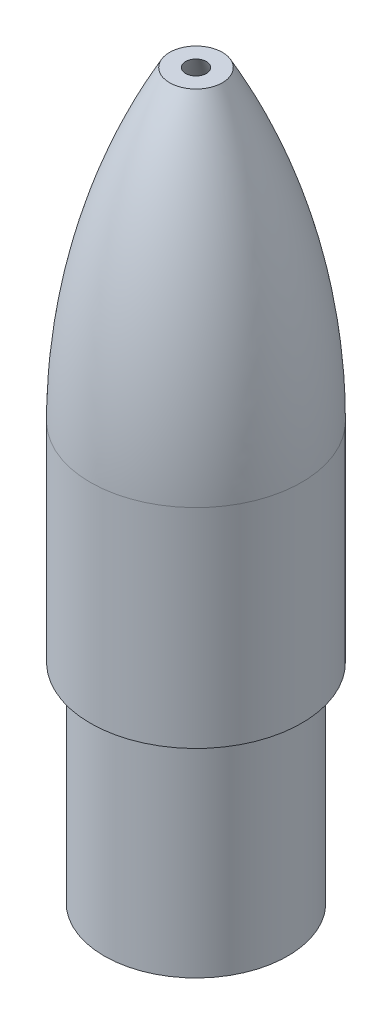
from build123d import *

# Parameters (mm, degrees)
BOSS_EXTRUDE1_START = -300
SKETCH2_R           = 66
SKETCH2_R_2         = 58
BOSS_EXTRUDE1_DEPTH = 300
SKETCH3_R           = 132.244783432
CUT_EXTRUDE1_DEPTH  = 30


with BuildPart() as part:
    # Sketch1 → Revolve3 (revolve)
    with BuildSketch(Plane.XY, mode=Mode.PRIVATE) as revolve3_sk:
        with BuildLine():
            Line((76, -0.344450695), (76, 149.655549305))
            add(Edge.make_bspline(
                [(0.773326773, 400), (0.980987301, 399.685666805), (1.398059308, 399.052178662), (2.284541161, 397.700550841), (3.251241341, 396.211212549), (4.217116507, 394.710095548), (5.194582422, 393.178406868), (6.158529674, 391.654155139), (7.117841951, 390.123894266), (8.076303348, 388.581395306), (9.033719413, 387.026713906), (16.961041975, 374.037008419), (28.571782608, 353.014913091), (42.416505119, 323.258697721), (56.925249661, 282.331206246), (67.374040256, 242.08025425), (72.64853455, 209.220016816), (74.898010785, 183.923611768), (75.587535098, 169.173424136), (75.711753269, 165.955632222), (75.799260065, 163.208321649), (75.849799507, 161.393000412), (75.892883214, 159.587415565), (75.928787343, 157.784317211), (75.957511328, 155.967426666), (75.979054713, 154.18293971), (75.99341716, 152.40648291), (75.99880312, 150.790982345), (76, 150.032282914), (76, 149.655549305)],
                knots=[0.082616428, 0.082616428, 0.082616428, 0.082616428, 0.082616428, 0.088299706, 0.093982984, 0.099666263, 0.105349541, 0.111032819, 0.116716097, 0.122399375, 0.128082653, 0.133891142, 0.139699631, 0.313954311, 0.430124092, 0.546293874, 0.685697612, 0.836718331, 0.848335309, 0.865760775, 0.871569264, 0.877252541, 0.882935819, 0.888619096, 0.894302373, 0.899985651, 0.905668928, 0.911352205, 0.917035483, 0.917035483, 0.917035483, 0.917035483, 0.917035483], degree=4))
            Line((0.773326773, 400), (0.751990255, 381.399188372))
            add(Edge.make_bspline(
                [(0.751990255, 381.399188372), (0.873010956, 381.201299105), (3.80991255, 376.390848647), (12.106986141, 362.199887034), (29.393699031, 328.534275172), (48.723069726, 277.933780444), (60.486978792, 225.059949932), (64.620486576, 187.441870002), (65.581155817, 169.911010475), (65.839847213, 161.807957388), (65.916827257, 158.438692592), (65.954572398, 156.064661932), (65.971527827, 154.723430387), (65.981910919, 153.726401125), (65.989958451, 152.707134592), (65.995746725, 151.595575293), (65.999239242, 150.498770837), (66, 149.951992083), (66, 149.655549305)],
                knots=[0.132529105, 0.132529105, 0.132529105, 0.132529105, 0.134767619, 0.18691881, 0.291221192, 0.499825955, 0.708430719, 0.812733101, 0.864884292, 0.877922089, 0.890959887, 0.897478786, 0.900738235, 0.903997685, 0.907257134, 0.910516584, 0.913776033, 0.917035483, 0.917035483, 0.917035483, 0.917035483], degree=3))
            Line((66, 149.655549305), (66, -0.344450695))
            Line((66, -0.344450695), (76, -0.344450695))
        make_face()
    revolve(revolve3_sk.sketch.rotate(Axis((0, -198.817850362, 0), (0, -1, 0)), 270), axis=Axis((0, -198.817850362, 0), (0, -1, 0)))

    # Sketch2 → Boss-Extrude1 (add)
    with BuildSketch(Plane(origin=(0, 149.655549305, 0), x_dir=(1, 0, 0), z_dir=(0, 1, 0)).offset(BOSS_EXTRUDE1_START)):
        with Locations(Location((0, 0, 0), (0, 0, 270))):
            Circle(SKETCH2_R)
        with Locations(Location((0, 0, 0), (0, 0, 270))):
            Circle(SKETCH2_R_2, mode=Mode.SUBTRACT)
    extrude(amount=BOSS_EXTRUDE1_DEPTH)

    # Sketch3 → Cut-Extrude1 (cut)
    with BuildSketch(Plane(origin=(0, 400, 0), x_dir=(-1, 0, 0), z_dir=(0, -1, 0))):
        Circle(SKETCH3_R)
    extrude(amount=CUT_EXTRUDE1_DEPTH, mode=Mode.SUBTRACT)


solid = part.part
